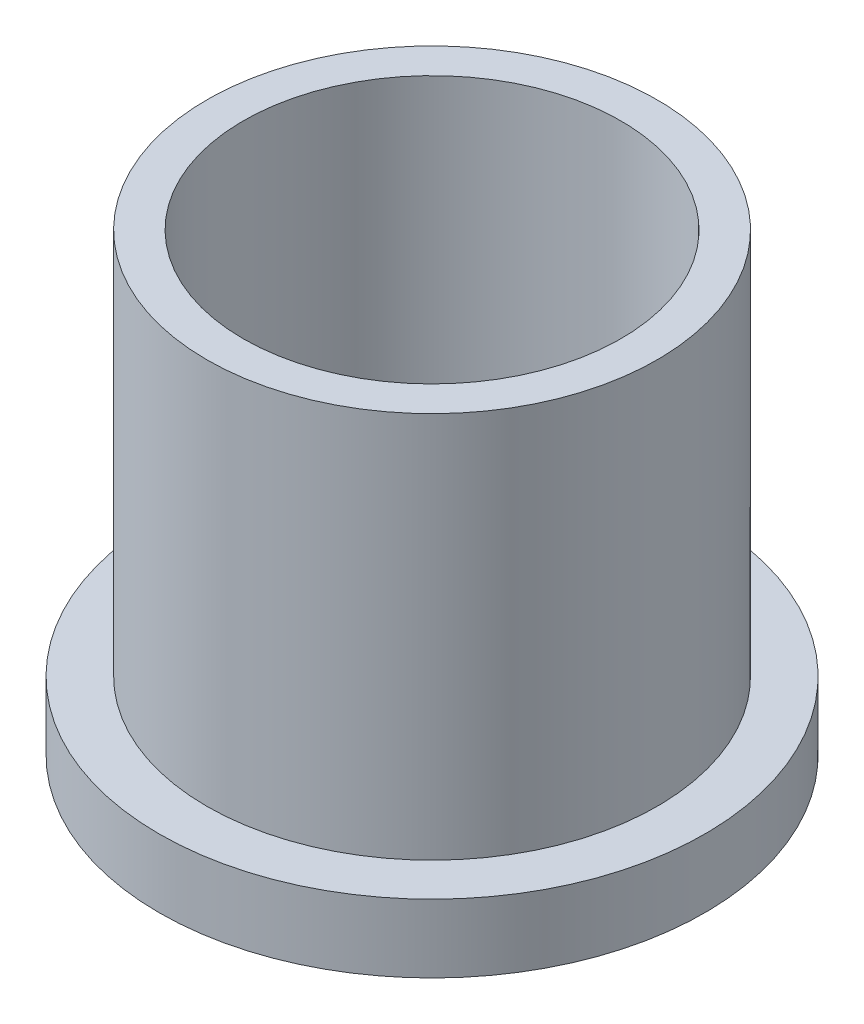
from build123d import *

# Parameters (mm, degrees)
CROQUIS1_R              = 4.95
CROQUIS1_R_2            = 4.15
SALIENTE_EXTRUIR1_DEPTH = 10
CROQUIS1_3_R            = 6
CROQUIS1_3_R_2          = 4.95
SALIENTE_EXTRUIR2_DEPTH = 1.5


with BuildPart() as part:
    # Croquis1 → Saliente-Extruir1 (new body)
    with BuildSketch(Plane(origin=(0, 0, 0), x_dir=(1, 0, 0), z_dir=(0, 1, 0))):
        Circle(CROQUIS1_R)
        Circle(CROQUIS1_R_2, mode=Mode.SUBTRACT)
    extrude(amount=SALIENTE_EXTRUIR1_DEPTH)

    # Croquis1<3> → Saliente-Extruir2 (add)
    with BuildSketch(Plane(origin=(0, 0, 0), x_dir=(1, 0, 0), z_dir=(0, 1, 0))):
        Circle(CROQUIS1_3_R)
        Circle(CROQUIS1_3_R_2, mode=Mode.SUBTRACT)
    extrude(amount=SALIENTE_EXTRUIR2_DEPTH)


solid = part.part
